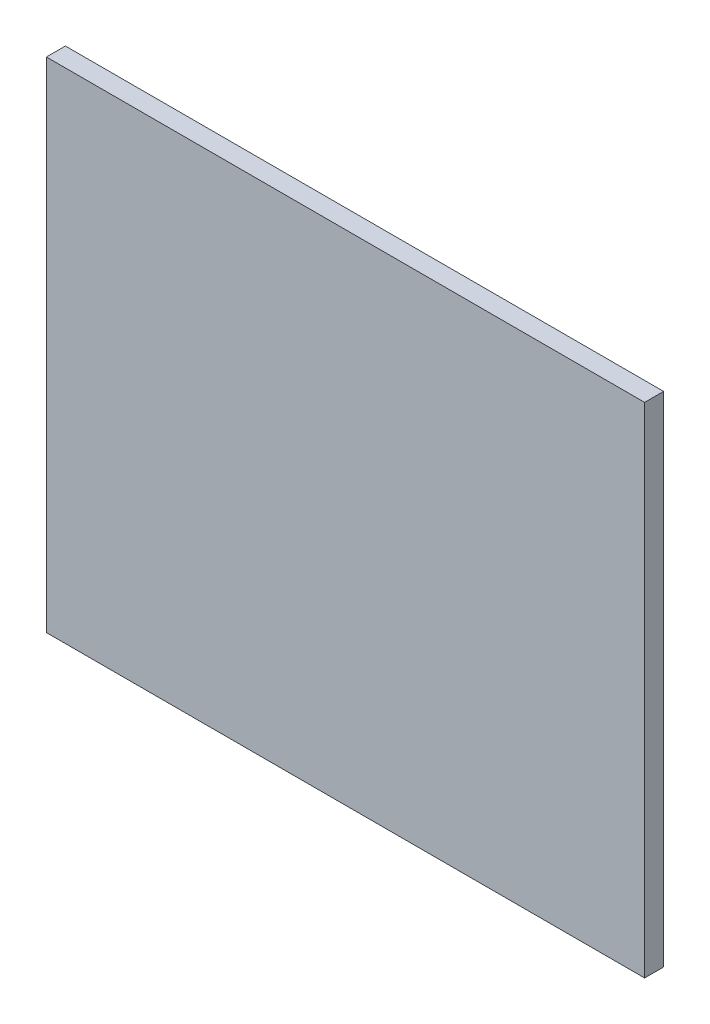
from build123d import *

# Parameters (mm, degrees)
BOSS_EXTRUDE1_DEPTH = 19.05


with BuildPart() as part:
    # Sketch1 → Boss-Extrude1 (new body)
    with BuildSketch(Plane.XY):
        Polygon((300, 185), (300, 250), (-300, 250), (-300, -250), (300, -250), align=None)
    extrude(amount=BOSS_EXTRUDE1_DEPTH)


solid = part.part
